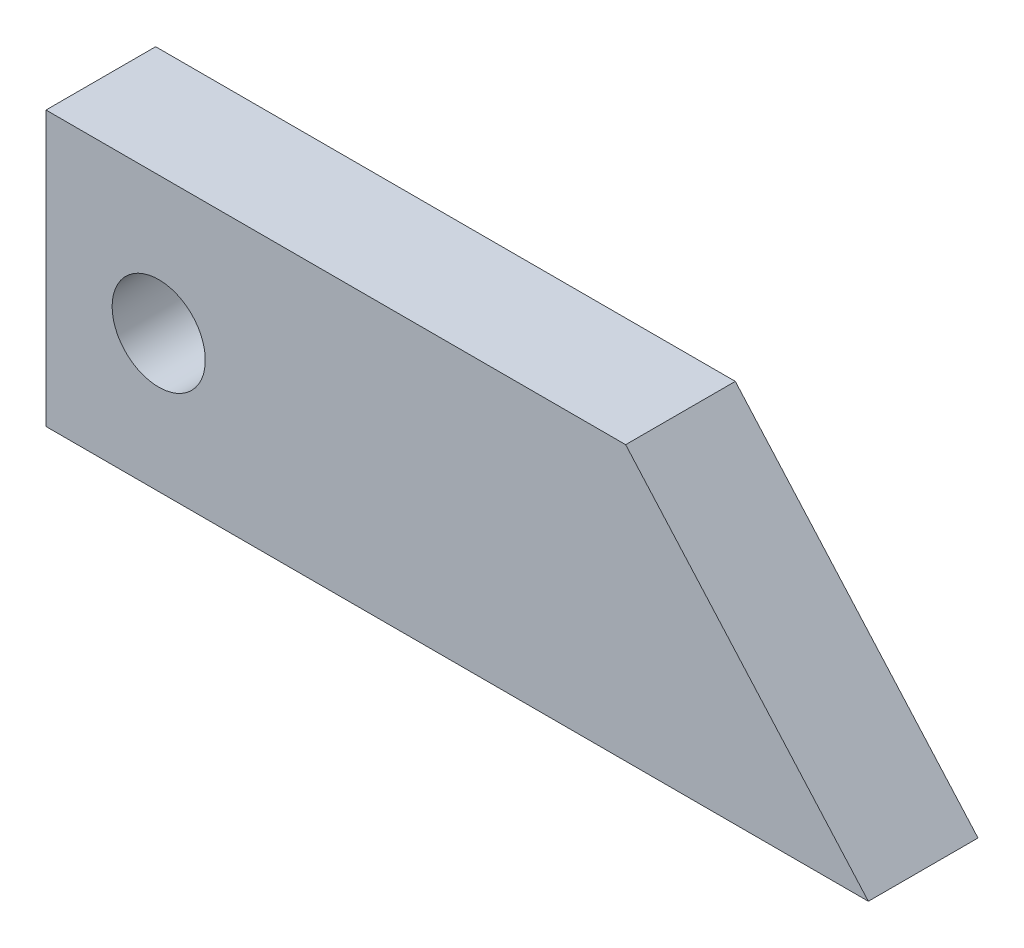
from build123d import *

# Parameters (mm, degrees)
EXTRUSION1_DEPTH                               = 4
FRAISAGE_POUR_VIS_T_TE_FRAIS_E_M31_D           = 3.4
FRAISAGE_POUR_VIS_T_TE_FRAIS_E_M31_CSINK_D     = 6.3
FRAISAGE_POUR_VIS_T_TE_FRAIS_E_M31_CSINK_ANGLE = 90


with BuildPart() as part:
    # Esquisse1 → Extrusion1 (new body)
    with BuildSketch(Plane.XY):
        Polygon((0, 0), (0, 10), (21.146637523, 10), (30, 0), align=None)
    extrude(amount=EXTRUSION1_DEPTH)

    # Fraisage pour vis à tête fraisée M31 (through all)
    with Locations(Plane(origin=(4.111822058, 5, 0), x_dir=(-1, 0, 0), z_dir=(0, 0, -1))):
        with Locations((0, 0)):
            CounterSinkHole(FRAISAGE_POUR_VIS_T_TE_FRAIS_E_M31_D / 2, FRAISAGE_POUR_VIS_T_TE_FRAIS_E_M31_CSINK_D / 2, counter_sink_angle=FRAISAGE_POUR_VIS_T_TE_FRAIS_E_M31_CSINK_ANGLE)


solid = part.part
